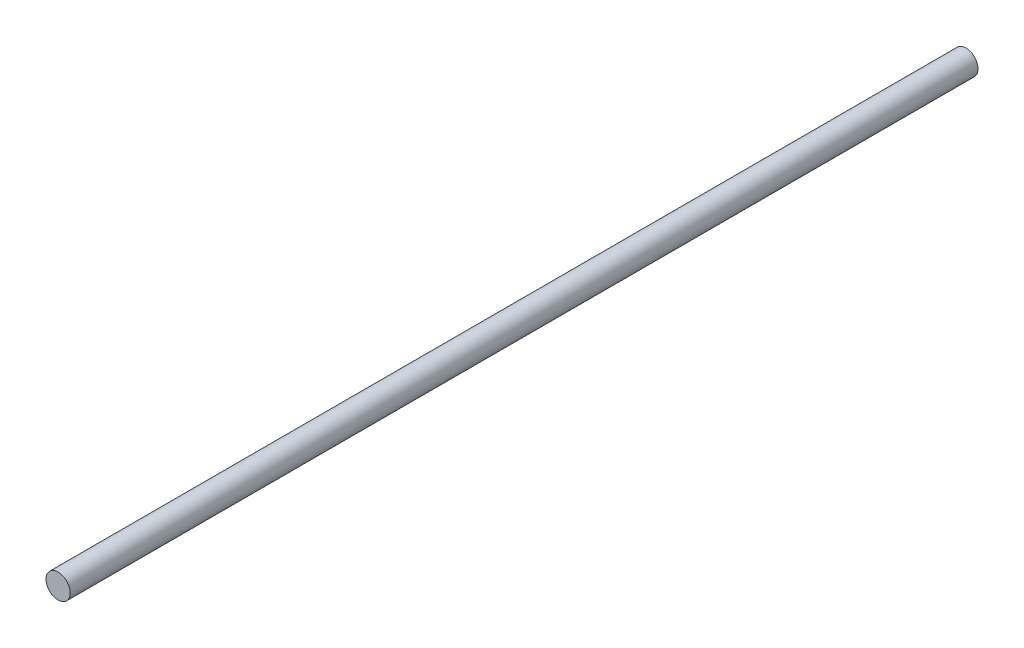
from build123d import *

# Parameters (mm, degrees)
SKETCH1_R           = 8
BOSS_EXTRUDE1_DEPTH = 600


with BuildPart() as part:
    # Sketch1 → Boss-Extrude1 (new body)
    with BuildSketch(Plane.XY):
        Circle(SKETCH1_R)
    extrude(amount=BOSS_EXTRUDE1_DEPTH)


solid = part.part
